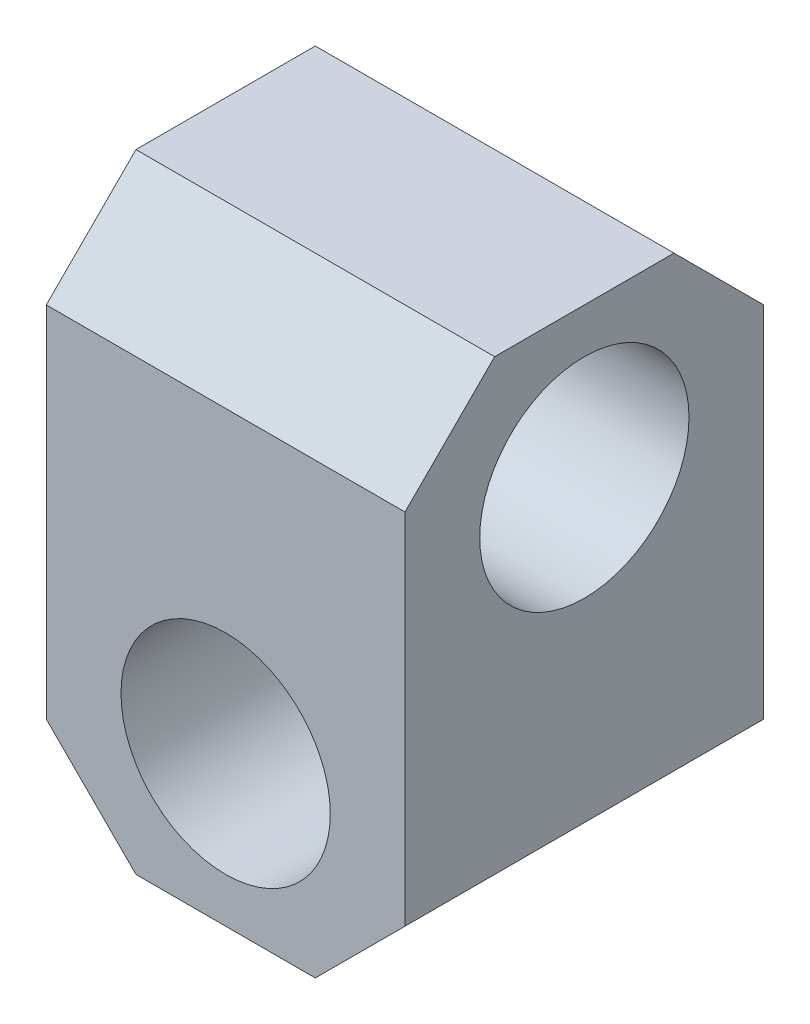
from build123d import *

# Parameters (mm, degrees)
SKETCH1_W               = 6
SKETCH1_H               = 6
BOSS_EXTRUDE1_DEPTH     = 4.5
CUT_EXTRUDE1_DEPTH      = 7.184658438
CUT_EXTRUDE1_DEPTH_BACK = 7.184658438
SKETCH2_R               = 1.75
SKETCH3_R               = 1.75
CUT_EXTRUDE2_DEPTH      = 9.077747211
CHAMFER1_SIZE           = 1.5


with BuildPart() as part:
    # Sketch1 → Boss-Extrude1 (new, symmetric)
    with BuildSketch(Plane(origin=(0, 0, 0), x_dir=(1, 0, 0), z_dir=(0, 1, 0))):
        Rectangle(SKETCH1_W, SKETCH1_H)
    extrude(amount=BOSS_EXTRUDE1_DEPTH, both=True)

    # Sketch2 → Cut-Extrude1 (cut, two sides: drawn at the far end of the back side and taken through both)
    with BuildSketch(Plane.XY.offset(-CUT_EXTRUDE1_DEPTH_BACK)):
        with Locations((0, -2)):
            Circle(SKETCH2_R)
    extrude(amount=CUT_EXTRUDE1_DEPTH + CUT_EXTRUDE1_DEPTH_BACK, mode=Mode.SUBTRACT)

    # Sketch3 → Cut-Extrude2 (cut, through all)
    with BuildSketch(Plane.ZY.offset(3)):
        with Locations((0, 2)):
            Circle(SKETCH3_R)
    extrude(amount=-CUT_EXTRUDE2_DEPTH, mode=Mode.SUBTRACT)

    # Chamfer1
    chamfer1_edges = [part.edges().sort_by_distance(p)[0] for p in [
        (0, 4.5, 3),
        (-3, -4.5, 0),
        (3, -4.5, 0),
        (0, 4.5, -3),
    ]]
    chamfer(chamfer1_edges, length=CHAMFER1_SIZE)


solid = part.part
